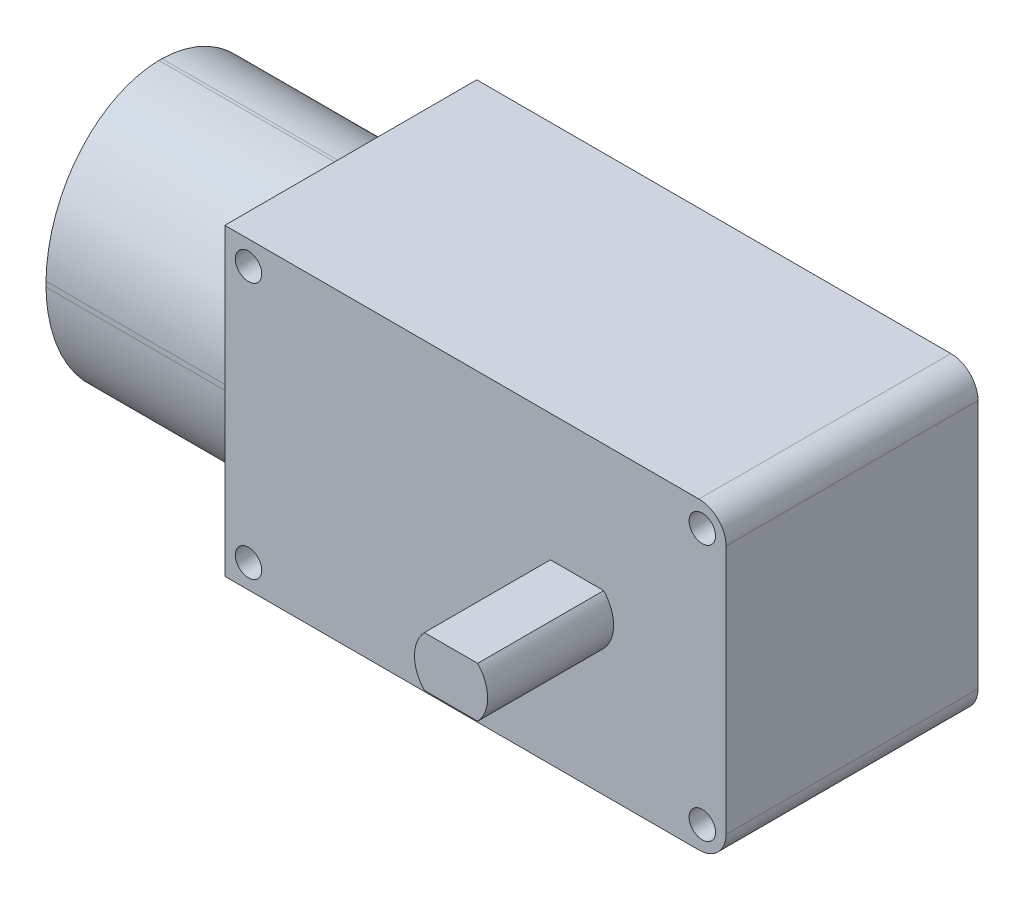
from build123d import *

# Parameters (mm, degrees)
SKETCH1_W                = 37
SKETCH1_H                = 22.44
BOSS_EXTRUDE1_DEPTH      = 18.6
FILLET1_R                = 2
SKETCH2_W                = 17
SKETCH2_H                = 20.38
BOSS_EXTRUDE2_DEPTH      = 14
BOSS_EXTRUDE3_DEPTH      = 9.3
BOSS_EXTRUDE3_DEPTH_BACK = 26.7
CUT_EXTRUDE1_DEPTH       = 14
SKETCH5_R                = 0.975
CUT_EXTRUDE2_DEPTH       = 45.278080455


with BuildPart() as part:
    # Sketch1 → Boss-Extrude1 (new body)
    with BuildSketch(Plane.XY):
        Rectangle(SKETCH1_W, SKETCH1_H)
    extrude(amount=BOSS_EXTRUDE1_DEPTH)

    # Fillet1
    fillet1_edges = [part.edges().sort_by_distance(p)[0] for p in [
        (18.5, 11.22, 9.3),
        (18.5, -11.22, 9.3),
    ]]
    fillet(fillet1_edges, radius=FILLET1_R)

    # Sketch2 → Boss-Extrude2 (add)
    with BuildSketch(Plane.ZY.offset(18.5)):
        with Locations((9.3, 0)):
            Rectangle(SKETCH2_W, SKETCH2_H)
    extrude(amount=BOSS_EXTRUDE2_DEPTH)

    # Sketch3 → Boss-Extrude3 (add, two sides: drawn at the far end of the back side and taken through both)
    with BuildSketch(Plane.XY.offset(18.6).offset(-BOSS_EXTRUDE3_DEPTH_BACK)):
        with BuildLine():
            Line((5.533403956, 1.85), (9.466596044, 1.85))
            ThreePointArc((9.466596044, 1.85), (10.2, 0), (9.466596044, -1.85))
            Line((9.466596044, -1.85), (5.533403956, -1.85))
            ThreePointArc((5.533403956, -1.85), (4.8, 0), (5.533403956, 1.85))
        make_face()
    extrude(amount=BOSS_EXTRUDE3_DEPTH + BOSS_EXTRUDE3_DEPTH_BACK)

    # Sketch4 → Cut-Extrude1 (cut)
    with BuildSketch(Plane.ZY.offset(32.5)):
        with BuildLine():
            Line((0.8, 10.19), (0.8, 0.135437192))
            add(Edge.make_bspline(
                [(9.236397672, 10.19), (0.95810585, 10.058115826), (0.8, 0.135437192)],
                knots=[0.026580808, 0.026580808, 0.026580808, 1.570796327, 1.570796327, 1.570796327], degree=2, weights=[1, 0.71644179, 1]))
            Line((9.236397672, 10.19), (0.8, 10.19))
        make_face()
        with BuildLine():
            Line((17.8, 10.19), (9.462365292, 10.19))
            add(Edge.make_bspline(
                [(17.8, 0.25381428), (17.64372138, 10.059640013), (9.462365292, 10.19)],
                knots=[4.750587933, 4.750587933, 4.750587933, 6.283185307, 6.283185307, 6.283185307], degree=2, weights=[1, 0.72048236, 1]))
            Line((17.8, 0.25381428), (17.8, 10.19))
        make_face()
        with BuildLine():
            add(Edge.make_bspline(
                [(9.363602328, -10.19), (17.64189415, -10.058115826), (17.8, -0.135437192)],
                knots=[3.168173462, 3.168173462, 3.168173462, 4.71238898, 4.71238898, 4.71238898], degree=2, weights=[1, 0.71644179, 1]))
            Line((9.363602328, -10.19), (17.8, -10.19))
            Line((17.8, -10.19), (17.8, -0.135437192))
        make_face()
        with BuildLine():
            add(Edge.make_bspline(
                [(0.8, -0.25381428), (0.95627862, -10.059640013), (9.137634708, -10.19)],
                knots=[1.608995279, 1.608995279, 1.608995279, 3.141592654, 3.141592654, 3.141592654], degree=2, weights=[1, 0.72048236, 1]))
            Line((0.8, -0.25381428), (0.8, -10.19))
            Line((0.8, -10.19), (9.137634708, -10.19))
        make_face()
    extrude(amount=-CUT_EXTRUDE1_DEPTH, mode=Mode.SUBTRACT)

    # Sketch5 → Cut-Extrude2 (cut, through all)
    with BuildSketch(Plane(origin=(0, 0, 0), x_dir=(-1, 0, 0), z_dir=(0, 0, -1))):
        with Locations((-16.75, 9.47)):
            Circle(SKETCH5_R)
        with Locations((-16.75, -9.47)):
            Circle(SKETCH5_R)
        with Locations((16.75, -9.47)):
            Circle(SKETCH5_R)
        with Locations((16.75, 9.47)):
            Circle(SKETCH5_R)
    extrude(amount=-CUT_EXTRUDE2_DEPTH, mode=Mode.SUBTRACT)


solid = part.part
